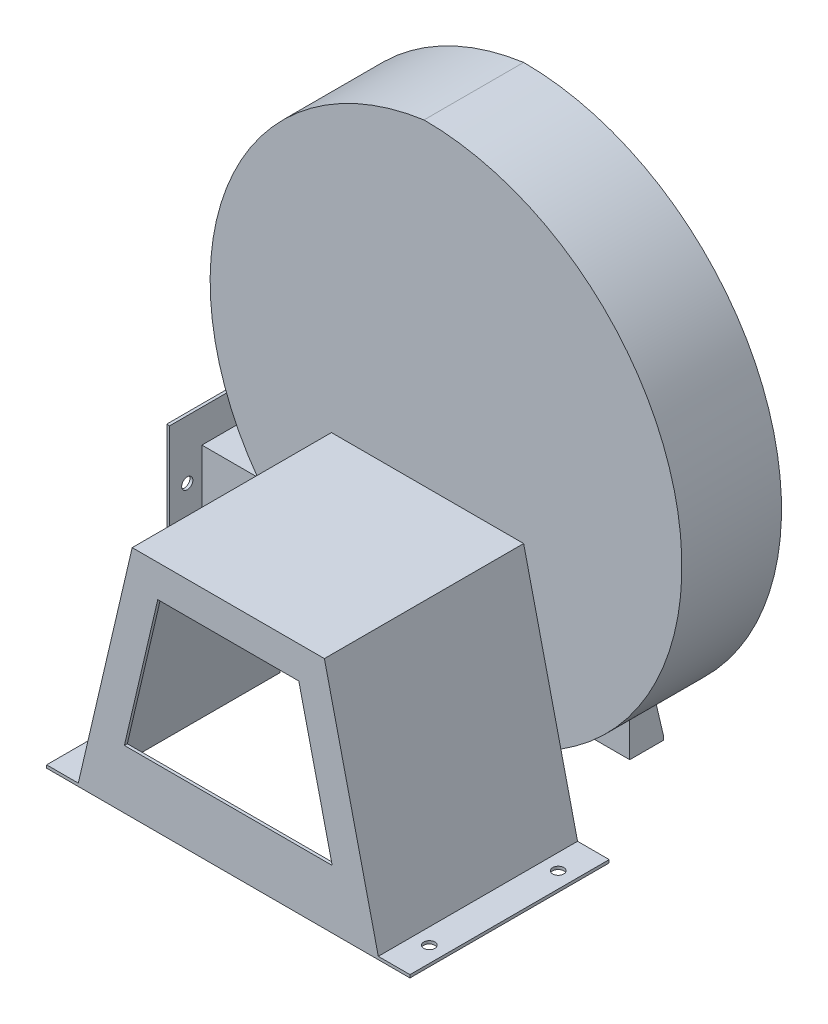
from build123d import *

# Parameters (mm, degrees)
SALIENTE_EXTRUIR1_DEPTH  = 170
SALIENTE_EXTRUIR2_DEPTH  = 2.5
CROQUIS4_R               = 4.7625
CORTAR_EXTRUIR1_DEPTH    = 2.5
SALIENTE_EXTRUIR3_DEPTH  = 2.5
SALIENTE_EXTRUIR4_DEPTH  = 80
SALIENTE_EXTRUIR5_DEPTH  = 2.5
CROQUIS8_W               = 140
CROQUIS8_H               = 161
CROQUIS8_W_2             = 80
CROQUIS8_H_2             = 101
SALIENTE_EXTRUIR6_DEPTH  = 2.5
CROQUIS9_R               = 4.7625
CORTAR_EXTRUIR2_DEPTH    = 2.5
CROQUIS10_R              = 61
CORTAR_EXTRUIR3_DEPTH    = 2.5
SALIENTE_EXTRUIR7_START  = 28.5
CROQUIS11_R              = 63.5
CROQUIS11_R_2            = 61
SALIENTE_EXTRUIR7_DEPTH  = 28.5
CROQUIS12_R              = 88
CROQUIS12_R_2            = 61
SALIENTE_EXTRUIR8_DEPTH  = 2.5
CROQUIS13_W              = 175
CROQUIS13_H              = 115
SALIENTE_EXTRUIR9_DEPTH  = 2.5
CROQUIS14_W              = 175
CROQUIS14_H              = 2.5
SALIENTE_EXTRUIR10_DEPTH = 26.5
SALIENTE_EXTRUIR11_DEPTH = 2.5
SALIENTE_EXTRUIR12_DEPTH = 2.5
CROQUIS17_R              = 4.7625
CORTAR_EXTRUIR4_DEPTH    = 2.5
CROQUIS18_R              = 154
SALIENTE_EXTRUIR13_DEPTH = 2.5
CROQUIS19_R              = 3.96875
SALIENTE_EXTRUIR14_DEPTH = 16
MATRIZC1_COUNT           = 6
CROQUIS20_R              = 3.96875
SALIENTE_EXTRUIR15_DEPTH = 7
MATRIZC3_COUNT           = 6
ESCALA1_SCALE            = 2


with BuildPart() as part:
    # Croquis1 → Saliente-Extruir1 (new body)
    with BuildSketch(Plane.XY):
        Polygon((0, 0), (29, 0), (75, 197), (235, 197), (281, 0), (310, 0), (310, 2.5), (282.983493442, 2.5), (236.983493442, 199.5), (73.016506558, 199.5), (27.016506558, 2.5), (0, 2.5), align=None)
    extrude(amount=SALIENTE_EXTRUIR1_DEPTH)

    # Croquis2 → Saliente-Extruir2 (add)
    with BuildSketch(Plane.XY.offset(170)):
        Polygon((29, 0), (281, 0), (269.286291687, 50.165229078), (235, 197), (75, 197), (40.713708313, 50.165229078), align=None)
        Polygon((243.652375223, 50), (66.347624777, 50), (94.834934422, 172), (215.165065578, 172), align=None, mode=Mode.SUBTRACT)
    extrude(amount=-SALIENTE_EXTRUIR2_DEPTH)

    # Croquis4 → Cortar-Extruir1 (cut)
    with BuildSketch(Plane(origin=(0, 2.5, 0), x_dir=(1, 0, 0), z_dir=(0, 1, 0))):
        with Locations(Location((13.508253279, -30, 0), (0, 0, 270))):
            Circle(CROQUIS4_R)
        with Locations(Location((13.508253279, -140, 0), (0, 0, 270))):
            Circle(CROQUIS4_R)
        with Locations(Location((296.491746721, -140, 0), (0, 0, 90))):
            Circle(CROQUIS4_R)
        with Locations(Location((296.491746721, -30, 0), (0, 0, 90))):
            Circle(CROQUIS4_R)
    extrude(amount=-CORTAR_EXTRUIR1_DEPTH, mode=Mode.SUBTRACT)

    # Croquis5 → Saliente-Extruir3 (add)
    with BuildSketch(Plane(origin=(0, 0, 0), x_dir=(-1, 0, 0), z_dir=(0, 0, -1))):
        with BuildLine():
            Line((0, 30), (40, 30))
            Line((40, 30), (40, 135))
            Line((40, 135), (-10, 135))
            ThreePointArc((-10, 135), (13.653759217, 342.621891967), (-152, 470))
            ThreePointArc((-152, 470), (-372, 250), (-152, 30))
            Line((-152, 30), (0, 30))
        make_face()
    extrude(amount=SALIENTE_EXTRUIR3_DEPTH)

    # Croquis6 → Saliente-Extruir4 (add)
    with BuildSketch(Plane(origin=(0, 0, -2.5), x_dir=(-1, 0, 0), z_dir=(0, 0, -1))):
        with BuildLine():
            Line((-10, 135), (40, 135))
            Line((40, 135), (40, 133))
            Line((40, 133), (38, 133))
            Line((38, 133), (-13.968512136, 133))
            ThreePointArc((-13.968512136, 133), (12.60152192, 339.954109112), (-152.141403753, 467.99995414))
            ThreePointArc((-152.141403753, 467.99995414), (-369.999988535, 249.92929812), (-152, 32))
            Line((-152, 32), (38, 32))
            Line((38, 32), (40, 32))
            Line((40, 32), (40, 30))
            Line((40, 30), (-152, 30))
            ThreePointArc((-152, 30), (-372, 250), (-152, 470))
            ThreePointArc((-152, 470), (13.653759217, 342.621891967), (-10, 135))
        make_face()
    extrude(amount=SALIENTE_EXTRUIR4_DEPTH)

    # Croquis7 → Saliente-Extruir5 (add)
    with BuildSketch(Plane(origin=(0, 0, -82.5), x_dir=(-1, 0, 0), z_dir=(0, 0, -1))):
        with BuildLine():
            Line((-10, 135), (40, 135))
            Line((40, 135), (40, 30))
            Line((40, 30), (-152, 30))
            ThreePointArc((-152, 30), (-372, 250), (-152, 470))
            ThreePointArc((-152, 470), (13.653759217, 342.621891967), (-10, 135))
        make_face()
    extrude(amount=SALIENTE_EXTRUIR5_DEPTH)

    # Croquis8 → Saliente-Extruir6 (add)
    with BuildSketch(Plane.ZY.offset(40)):
        with Locations((-42.5, 82.5)):
            Rectangle(CROQUIS8_W, CROQUIS8_H)
        with Locations((-42.5, 82.5)):
            Rectangle(CROQUIS8_W_2, CROQUIS8_H_2, mode=Mode.SUBTRACT)
    extrude(amount=-SALIENTE_EXTRUIR6_DEPTH)

    # Croquis9 → Cortar-Extruir2 (cut)
    with BuildSketch(Plane.ZY.offset(40)):
        with Locations((-42.5, 148)):
            Circle(CROQUIS9_R)
        with Locations((-97.5, 113)):
            Circle(CROQUIS9_R)
        with Locations((12.5, 113)):
            Circle(CROQUIS9_R)
        with Locations(Location((12.5, 52, 0), (0, 0, 180))):
            Circle(CROQUIS9_R)
        with Locations(Location((-97.5, 52, 0), (0, 0, 180))):
            Circle(CROQUIS9_R)
        with Locations(Location((-42.5, 17, 0), (0, 0, 180))):
            Circle(CROQUIS9_R)
    extrude(amount=-CORTAR_EXTRUIR2_DEPTH, mode=Mode.SUBTRACT)

    # Croquis10 → Cortar-Extruir3 (cut)
    with BuildSketch(Plane(origin=(0, 0, -85), x_dir=(-1, 0, 0), z_dir=(0, 0, -1))):
        with Locations((-155, 279.5)):
            Circle(CROQUIS10_R)
    extrude(amount=-CORTAR_EXTRUIR3_DEPTH, mode=Mode.SUBTRACT)

    # Croquis11 → Saliente-Extruir7 (add)
    with BuildSketch(Plane(origin=(0, 0, -85), x_dir=(-1, 0, 0), z_dir=(0, 0, -1)).offset(SALIENTE_EXTRUIR7_START)):
        with Locations(Location((-155, 279.5, 0), (0, 0, 180))):
            Circle(CROQUIS11_R)
        with Locations((-155, 279.5)):
            Circle(CROQUIS11_R_2, mode=Mode.SUBTRACT)
    extrude(amount=-SALIENTE_EXTRUIR7_DEPTH)

    # Croquis12 → Saliente-Extruir8 (add)
    with BuildSketch(Plane(origin=(0, 0, -113.5), x_dir=(-1, 0, 0), z_dir=(0, 0, -1))):
        with Locations((-155, 279.5)):
            Circle(CROQUIS12_R)
        with Locations((-155, 279.5)):
            Circle(CROQUIS12_R_2, mode=Mode.SUBTRACT)
    extrude(amount=-SALIENTE_EXTRUIR8_DEPTH)

    # Croquis13 → Saliente-Extruir9 (add)
    with BuildSketch(Plane(origin=(0, 0, -85), x_dir=(-1, 0, 0), z_dir=(0, 0, -1))):
        with Locations((-155, 57.5)):
            Rectangle(CROQUIS13_W, CROQUIS13_H)
    extrude(amount=SALIENTE_EXTRUIR9_DEPTH)

    # Croquis14 → Saliente-Extruir10 (add)
    with BuildSketch(Plane(origin=(0, 0, -87.5), x_dir=(-1, 0, 0), z_dir=(0, 0, -1))):
        with Locations((-155, 1.25)):
            Rectangle(CROQUIS14_W, CROQUIS14_H)
    extrude(amount=SALIENTE_EXTRUIR10_DEPTH)

    # Croquis15 → Saliente-Extruir11 (add)
    with BuildSketch(Plane.ZY.offset(-67.5)):
        Polygon((-114, 2.5), (-87.5, 115), (-85, 115), (-85, 0), (-114, 0), align=None)
    extrude(amount=-SALIENTE_EXTRUIR11_DEPTH)

    # Croquis16 → Saliente-Extruir12 (add)
    with BuildSketch(Plane(origin=(242.5, 0, 0), x_dir=(0, 0, -1), z_dir=(1, 0, 0))):
        Polygon((114, 2.5), (87.5, 115), (85, 115), (85, 0), (114, 0), align=None)
    extrude(amount=-SALIENTE_EXTRUIR12_DEPTH)

    # Croquis17 → Cortar-Extruir4 (cut)
    with BuildSketch(Plane.XZ):
        with Locations(Location((198.5, -100.75, 0), (0, 0, 270))):
            Circle(CROQUIS17_R)
        with Locations(Location((111.5, -100.75, 0), (0, 0, 270))):
            Circle(CROQUIS17_R)
    extrude(amount=-CORTAR_EXTRUIR4_DEPTH, mode=Mode.SUBTRACT)

    # Croquis18 → Saliente-Extruir13 (add)
    with BuildSketch(Plane(origin=(0, 0, -85), x_dir=(-1, 0, 0), z_dir=(0, 0, -1))):
        with Locations(Location((-155, 279.5, 0), (0, 0, 180))):
            Circle(CROQUIS18_R)
    extrude(amount=SALIENTE_EXTRUIR13_DEPTH)

    # Croquis19 → Saliente-Extruir14 (add)
    with BuildSketch(Plane(origin=(0, 0, -87.5), x_dir=(-1, 0, 0), z_dir=(0, 0, -1))):
        with Locations((-13, 279.5)):
            Circle(CROQUIS19_R)
    saliente_extruir14 = extrude(amount=SALIENTE_EXTRUIR14_DEPTH)

    # MatrizC1: Saliente-Extruir14 ×6 about axis
    matrizc1_axis = Axis((155, 279.5, 0), (0, 0, 1))
    for i in range(1, MATRIZC1_COUNT):
        add(saliente_extruir14.rotate(matrizc1_axis, i * 360 / MATRIZC1_COUNT))

    # Croquis20 → Saliente-Extruir15 (add)
    with BuildSketch(Plane(origin=(0, 0, -87.5), x_dir=(-1, 0, 0), z_dir=(0, 0, -1))):
        Polygon((-6.07179677, 279.5), (-9.535898385, 285.5), (-16.464101615, 285.5), (-19.92820323, 279.5), (-16.464101615, 273.5), (-9.535898385, 273.5), align=None)
        with Locations((-13, 279.5)):
            Circle(CROQUIS20_R, mode=Mode.SUBTRACT)
    saliente_extruir15 = extrude(amount=SALIENTE_EXTRUIR15_DEPTH)

    # MatrizC3: Saliente-Extruir15 ×6 about axis
    matrizc3_axis = Axis((155, 279.5, 0), (0, 0, 1))
    for i in range(1, MATRIZC3_COUNT):
        add(saliente_extruir15.rotate(matrizc3_axis, i * 360 / MATRIZC3_COUNT))


with BuildPart() as part_1:
    # Escala1: scaled about (153.867838304, 207.115658643, -22.79882081)
    add(part.part.scale(ESCALA1_SCALE).moved(Location((-153.867838304, -207.115658643, 22.79882081))))


solid = part_1.part
